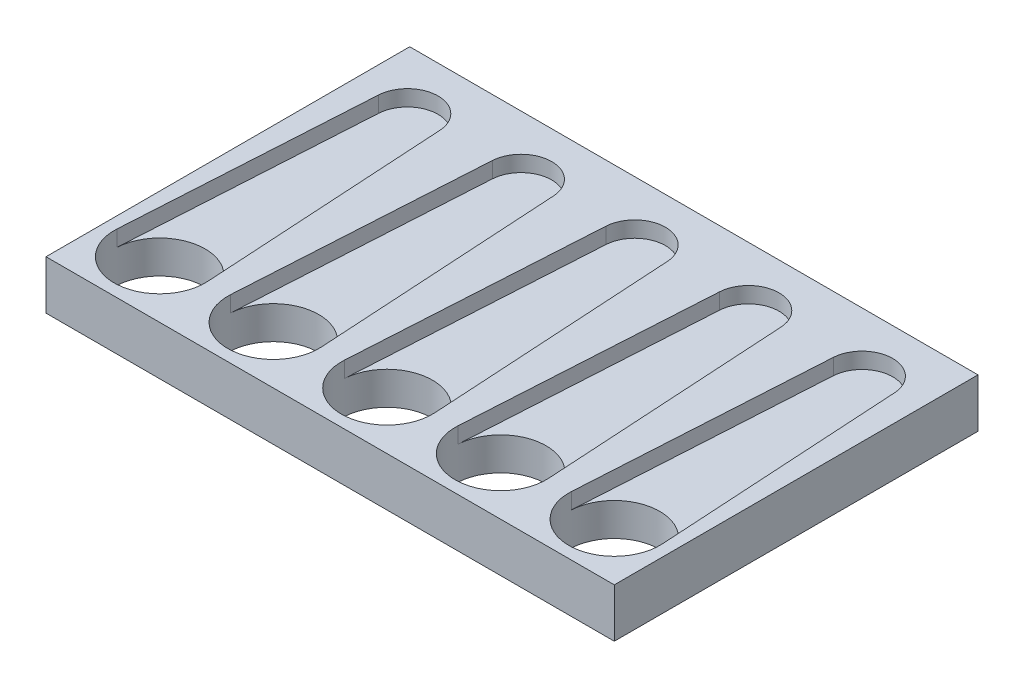
from build123d import *

# Parameters (mm, degrees)
SKETCH1_W           = 10
SKETCH1_H           = 32
BOSS_EXTRUDE1_DEPTH = 1.4
BOSS_EXTRUDE2_START = -2.9
SKETCH1_3_W         = 10
SKETCH1_3_H         = 32
SKETCH1_3_R         = 4
BOSS_EXTRUDE2_DEPTH = 2.9
LPATTERN1_COUNT     = 5
LPATTERN1_PITCH     = 10


with BuildPart() as part:
    # Sketch1 → Boss-Extrude1 (new body)
    with BuildSketch(Plane(origin=(0, 0, 0), x_dir=(1, 0, 0), z_dir=(0, 1, 0))):
        with Locations((5, 16)):
            Rectangle(SKETCH1_W, SKETCH1_H)
        with BuildLine():
            Line((1.00711853, 5.23853211), (2.304805008, 26.961009174))
            ThreePointArc((2.304805008, 26.961009174), (5, 29.5), (7.695194992, 26.961009174))
            Line((7.695194992, 26.961009174), (8.99288147, 5.23853211))
            ThreePointArc((8.99288147, 5.23853211), (8.998219971, 5.119319153), (9, 5))
            ThreePointArc((9, 5), (4.880680847, 1.001780029), (1.00711853, 5.23853211))
        make_face(mode=Mode.SUBTRACT)
    boss_extrude1 = extrude(amount=BOSS_EXTRUDE1_DEPTH)

    # Sketch1<3> → Boss-Extrude2 (add)
    with BuildSketch(Plane(origin=(0, 0, 0), x_dir=(1, 0, 0), z_dir=(0, 1, 0)).offset(BOSS_EXTRUDE2_START)):
        with Locations((5, 16)):
            Rectangle(SKETCH1_3_W, SKETCH1_3_H)
        with Locations((5, 5)):
            Circle(SKETCH1_3_R, mode=Mode.SUBTRACT)
    boss_extrude2 = extrude(amount=BOSS_EXTRUDE2_DEPTH)

    # LPattern1: Boss-Extrude1, Boss-Extrude2 ×5
    with Locations(*[(i * LPATTERN1_PITCH, 0, 0) for i in range(1, LPATTERN1_COUNT)]):
        add(boss_extrude1)
        add(boss_extrude2)


solid = part.part
